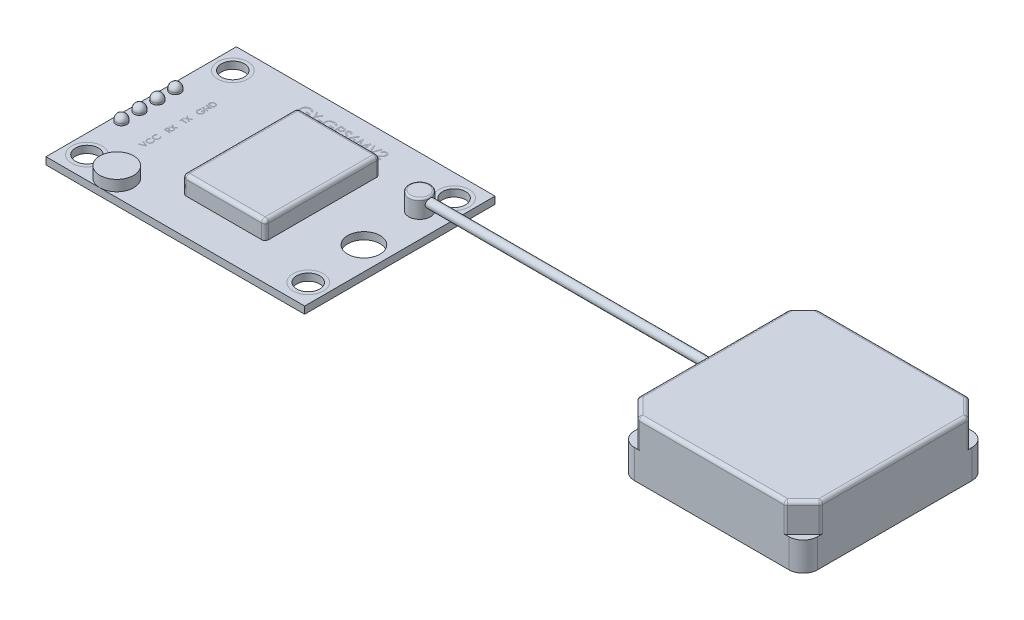
from build123d import *

# Parameters (mm, degrees)
CROQUIS1_W                   = 36
CROQUIS1_H                   = 26.5
CROQUIS1_R                   = 1.6
CROQUIS1_R_2                 = 2.25
SALIENTE_EXTRUIR1_DEPTH      = 1
CROQUIS2_W                   = 11.5
CROQUIS2_H                   = 16
SALIENTE_EXTRUIR2_DEPTH      = 2.5
REDONDEO1_R                  = 0.5
CROQUIS3_R                   = 2.35
SALIENTE_EXTRUIR3_DEPTH      = 1.5
SALIENTE_EXTRUIR4_DEPTH      = 1
SALIENTE_EXTRUIR4_DEPTH_BACK = 9.5
CROQUIS4_R                   = 0.75
REDONDEO2_R                  = 0.75
CROQUIS5_R                   = 1
CROQUIS5_W                   = 1.060660172
CROQUIS5_H                   = 1.060660172
CORTAR_EXTRUIR1_DEPTH        = 8.5
CROQUIS7_R                   = 1.5
SALIENTE_EXTRUIR5_DEPTH      = 2.5
REDONDEO3_R                  = 0.25
SALIENTE_EXTRUIR6_DEPTH      = 40
SALIENTE_EXTRUIR6_DEPTH_BACK = 1
CROQUIS10_R                  = 0.6
SALIENTE_EXTRUIR7_DEPTH      = 4
SALIENTE_EXTRUIR7_DEPTH_BACK = 4
CROQUIS11_W                  = 25.5
CROQUIS11_H                  = 25.5
CORTAR_EXTRUIR3_DEPTH        = 4
REDONDEO4_R                  = 2
REDONDEO5_R                  = 0.5


with BuildPart() as part:
    # Croquis1 → Saliente-Extruir1 (new body)
    with BuildSketch(Plane(origin=(0, 0, 0), x_dir=(1, 0, 0), z_dir=(0, 1, 0))):
        Rectangle(CROQUIS1_W, CROQUIS1_H)
        with Locations(Location((15.4, 10.15, 0), (0, 0, 270))):
            Circle(CROQUIS1_R, mode=Mode.SUBTRACT)
        with Locations(Location((15.4, -10.15, 0), (0, 0, 90))):
            Circle(CROQUIS1_R, mode=Mode.SUBTRACT)
        with Locations(Location((-15.4, -10.15, 0), (0, 0, 270))):
            Circle(CROQUIS1_R, mode=Mode.SUBTRACT)
        with Locations(Location((-15.4, 10.15, 0), (0, 0, 90))):
            Circle(CROQUIS1_R, mode=Mode.SUBTRACT)
        with Locations(Location((14.75, -1.75, 0), (0, 0, 270))):
            Circle(CROQUIS1_R_2, mode=Mode.SUBTRACT)
    extrude(amount=SALIENTE_EXTRUIR1_DEPTH)

    # Croquis2 → Saliente-Extruir2 (add)
    with BuildSketch(Plane(origin=(0, 1, 0), x_dir=(1, 0, 0), z_dir=(0, 1, 0))):
        with Locations((1.75, -0.25)):
            Rectangle(CROQUIS2_W, CROQUIS2_H)
    extrude(amount=SALIENTE_EXTRUIR2_DEPTH)

    # Redondeo1
    redondeo1_edges = [part.edges().sort_by_distance(p)[0] for p in [
        (-4, 2.25, -7.75),
        (-4, 2.25, 8.25),
        (7.5, 2.25, 8.25),
        (7.5, 2.25, -7.75),
        (-4, 3.5, 0.25),
        (1.75, 3.5, 8.25),
        (7.5, 3.5, 0.25),
        (1.75, 3.5, -7.75),
    ]]
    fillet(redondeo1_edges, radius=REDONDEO1_R)

    # Croquis3 → Saliente-Extruir3 (add)
    with BuildSketch(Plane(origin=(0, 1, 0), x_dir=(1, 0, 0), z_dir=(0, 1, 0))):
        with Locations(Location((-10.5, -10.9, 0), (0, 0, 270))):
            Circle(CROQUIS3_R)
    extrude(amount=SALIENTE_EXTRUIR3_DEPTH)

    # Croquis4 → Saliente-Extruir4 (add, two sides: drawn at the far end of the back side and taken through both)
    with BuildSketch(Plane(origin=(0, 1, 0), x_dir=(1, 0, 0), z_dir=(0, 1, 0)).offset(-SALIENTE_EXTRUIR4_DEPTH_BACK)):
        with Locations(Location((-17, -1.25, 0), (0, 0, 270))):
            Circle(CROQUIS4_R)
        with Locations(Location((-17, -3.75, 0), (0, 0, 270))):
            Circle(CROQUIS4_R)
        with Locations(Location((-17, 1.25, 0), (0, 0, 270))):
            Circle(CROQUIS4_R)
        with Locations(Location((-17, 3.75, 0), (0, 0, 270))):
            Circle(CROQUIS4_R)
    extrude(amount=SALIENTE_EXTRUIR4_DEPTH + SALIENTE_EXTRUIR4_DEPTH_BACK)

    # Redondeo2
    redondeo2_edges = [part.edges().sort_by_distance(p)[0] for p in [
        (-17, 2, 3),
        (-17, 2, 0.5),
        (-17, 2, -4.5),
        (-17, 2, -2),
    ]]
    fillet(redondeo2_edges, radius=REDONDEO2_R)

    # Croquis5 → Cortar-Extruir1 (cut)
    # profile 1 of 4: a face of its own
    with BuildSketch(Plane.XZ.offset(8.5)):
        with Locations((-17, 3.75)):
            Circle(CROQUIS5_R)
        with Locations((-17, 3.75)):
            Rectangle(CROQUIS5_W, CROQUIS5_H, mode=Mode.SUBTRACT)
    # profile 2 of 4: a face of its own
    with BuildSketch(Plane.XZ.offset(8.5)):
        with Locations((-17, 1.25)):
            Circle(CROQUIS5_R)
        with Locations((-17, 1.25)):
            Rectangle(CROQUIS5_W, CROQUIS5_H, mode=Mode.SUBTRACT)
    # profile 3 of 4: a face of its own
    with BuildSketch(Plane.XZ.offset(8.5)):
        with Locations((-17, -1.25)):
            Circle(CROQUIS5_R)
        with Locations((-17, -1.25)):
            Rectangle(CROQUIS5_W, CROQUIS5_H, mode=Mode.SUBTRACT)
    # profile 4 of 4: a face of its own
    with BuildSketch(Plane.XZ.offset(8.5)):
        with Locations((-17, -3.75)):
            Circle(CROQUIS5_R)
        with Locations((-17, -3.75)):
            Rectangle(CROQUIS5_W, CROQUIS5_H, mode=Mode.SUBTRACT)
    extrude(amount=-CORTAR_EXTRUIR1_DEPTH, mode=Mode.SUBTRACT)

    # Croquis7 → Saliente-Extruir5 (add)
    with BuildSketch(Plane(origin=(0, 1, 0), x_dir=(1, 0, 0), z_dir=(0, 1, 0))):
        with Locations(Location((14.5, 6.25, 0), (0, 0, 270))):
            Circle(CROQUIS7_R)
    extrude(amount=SALIENTE_EXTRUIR5_DEPTH)

    # Redondeo3
    redondeo3_edges = [part.edges().sort_by_distance(p)[0] for p in [
        (14.5, 3.5, -7.75),
    ]]
    fillet(redondeo3_edges, radius=REDONDEO3_R)

    # Croquis10 → Saliente-Extruir6 (add, two sides: drawn at the far end of the back side and taken through both)
    with BuildSketch(Plane(origin=(16, 0, 0), x_dir=(0, 0, -1), z_dir=(1, 0, 0)).offset(-SALIENTE_EXTRUIR6_DEPTH_BACK)):
        with Locations((6.25, 2.65)):
            Circle(CROQUIS10_R)
    extrude(amount=SALIENTE_EXTRUIR6_DEPTH + SALIENTE_EXTRUIR6_DEPTH_BACK)


with BuildPart() as body_2:
    # Croquis11 → Saliente-Extruir7 (new, two sides: drawn at the far end of the back side and taken through both)
    with BuildSketch(Plane(origin=(0, 0, 0), x_dir=(1, 0, 0), z_dir=(0, 1, 0)).offset(-SALIENTE_EXTRUIR7_DEPTH_BACK)):
        with Locations((67.75, 6.4)):
            Rectangle(CROQUIS11_W, CROQUIS11_H)
    extrude(amount=SALIENTE_EXTRUIR7_DEPTH + SALIENTE_EXTRUIR7_DEPTH_BACK)

    # Croquis13 → Cortar-Extruir3 (cut)
    with BuildSketch(Plane(origin=(0, 4, 0), x_dir=(1, 0, 0), z_dir=(0, 1, 0))):
        Polygon((55, 16.667614595), (57.482385405, 19.15), (55, 19.15), align=None)
        Polygon((80.5, 19.15), (80.5, 16.667614595), (78.017614595, 19.15), align=None)
        Polygon((80.5, -3.867614595), (78.017614595, -6.35), (80.5, -6.35), align=None)
        Polygon((55, -6.35), (55, -3.867614595), (57.482385405, -6.35), align=None)
    extrude(amount=-CORTAR_EXTRUIR3_DEPTH, mode=Mode.SUBTRACT)

    # Redondeo4
    redondeo4_edges = [body_2.edges().sort_by_distance(p)[0] for p in [
        (55, -2, -19.15),
        (80.5, -2, -19.15),
        (80.5, -2, 6.35),
        (55, -2, 6.35),
    ]]
    fillet(redondeo4_edges, radius=REDONDEO4_R)

    # Redondeo5
    redondeo5_edges = [body_2.edges().sort_by_distance(p)[0] for p in [
        (55, 4, -6.4),
        (67.75, 4, 6.35),
        (80.5, 4, -6.4),
        (67.75, 4, -19.15),
        (55, 2, -16.667614595),
        (57.482385405, 2, -19.15),
        (78.017614595, 2, -19.15),
        (80.5, 2, -16.667614595),
        (79.258807297, 4, -17.908807297),
        (80.5, 2, 3.867614595),
        (78.017614595, 2, 6.35),
        (79.258807297, 4, 5.108807297),
        (57.482385405, 2, 6.35),
        (55, 2, 3.867614595),
        (56.241192703, 4, 5.108807297),
    ]]
    fillet(redondeo5_edges, radius=REDONDEO5_R)


solid = Compound([part.part, body_2.part])
